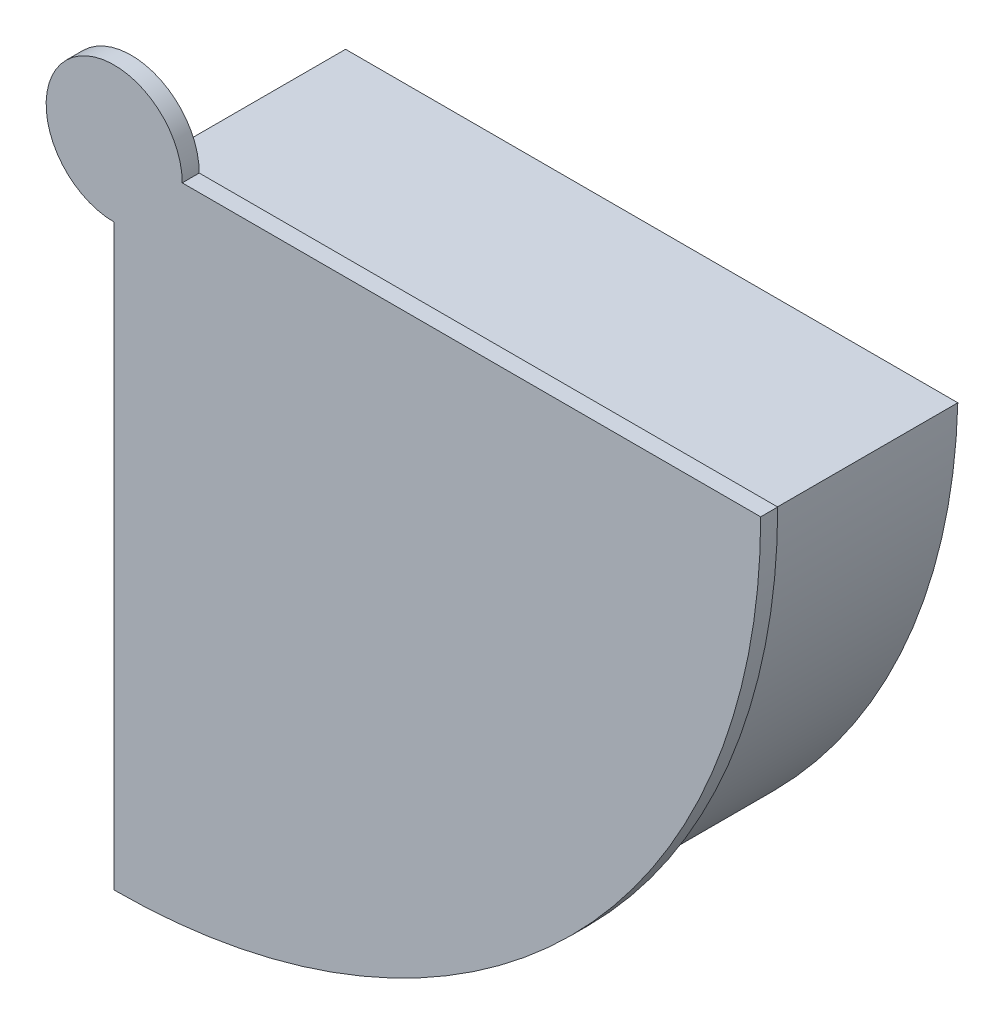
from build123d import *

# Parameters (mm, degrees)
EXTRUDE_1_DEPTH = 5
EXTRUDE_2_DEPTH = 58
SKETCH_3_R      = 20
EXTRUDE_3_DEPTH = 5


with BuildPart() as part:
    # 草图1 → 凸台-拉伸1 (new body)
    with BuildSketch(Plane.XY):
        with BuildLine():
            Line((0, 0), (0, -190))
            ThreePointArc((0, -190), (134.350288425, -134.350288425), (190, 0))
            Line((190, 0), (0, 0))
        make_face()
    extrude(amount=EXTRUDE_1_DEPTH)

    # 草图2 → 凸台-拉伸2 (add)
    with BuildSketch(Plane(origin=(0, 0, 0), x_dir=(-1, 0, 0), z_dir=(0, 0, -1))):
        with BuildLine():
            Line((-5, -5), (-184.932420089, -5))
            ThreePointArc((-184.932420089, -5), (-130.81475452, -130.81475452), (-5, -184.932420089))
            Line((-5, -184.932420089), (-5, -5))
        make_face()
        with BuildLine():
            Line((-9.755273715, -10.014049165), (-9.755273715, -179.735457367))
            ThreePointArc((-9.755273715, -179.735457367), (-127.187558429, -127.370816834), (-179.721225289, -10.014049165))
            Line((-179.721225289, -10.014049165), (-9.755273715, -10.014049165))
        make_face(mode=Mode.SUBTRACT)
    extrude(amount=EXTRUDE_2_DEPTH)

    # 草图3 → 凸台-拉伸3 (add)
    with BuildSketch(Plane.XY.offset(5)):
        Circle(SKETCH_3_R)
    extrude(amount=-EXTRUDE_3_DEPTH)


solid = part.part
